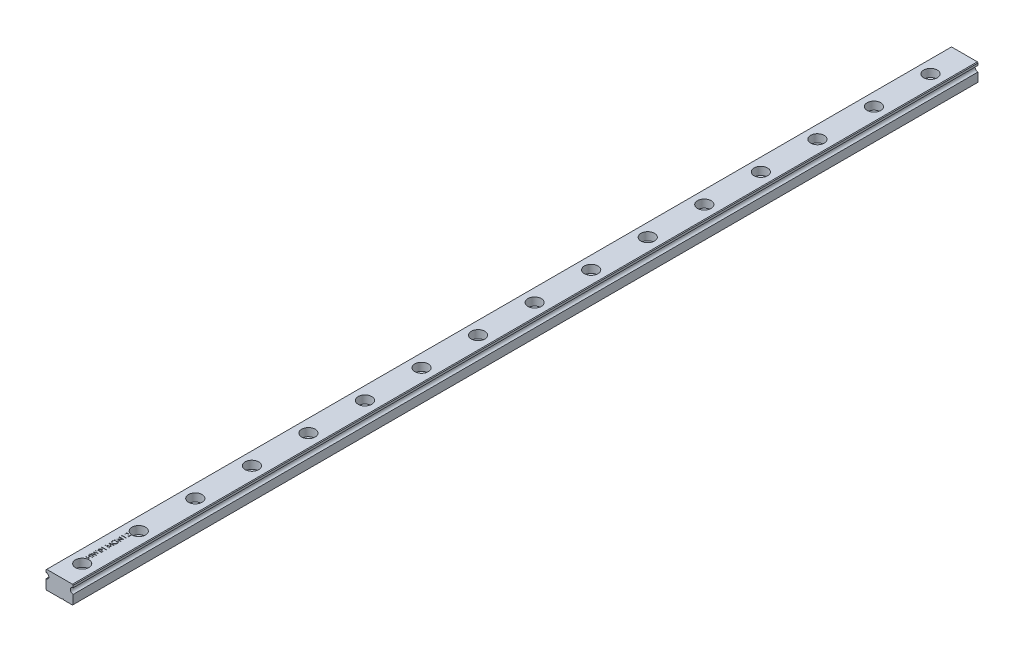
from build123d import *

# Parameters (mm, degrees)
EXTRUDE_1_DEPTH              = 400
HOLE_WIZARD_M3_1_D           = 3.5
HOLE_WIZARD_M3_1_CBORE_D     = 6
HOLE_WIZARD_M3_1_CBORE_DEPTH = 3.5
PATTERN_LINEAR_1_COUNT       = 16
PATTERN_LINEAR_1_PITCH       = 25
SKETCH_6_W                   = 2
SKETCH_6_H                   = 0.17948718
CUT_EXTRUDE_1_DEPTH          = 0.1


with BuildPart() as part:
    # 草图1 → 凸台-拉伸1 (new body)
    with BuildSketch(Plane.XY):
        with BuildLine():
            Line((-5.7, 0), (1.2, 0))
            ThreePointArc((1.2, 0), (1.5, 0.3), (1.8, 0))
            Line((1.8, 0), (5.7, 0))
            Line((5.7, 0), (6, 0.3))
            Line((6, 0.3), (6, 4.25))
            ThreePointArc((6, 4.25), (4.75, 5.5), (6, 6.75))
            Line((6, 6.75), (6, 7.7))
            Line((6, 7.7), (5.7, 8))
            Line((5.7, 8), (-5.7, 8))
            Line((-5.7, 8), (-6, 7.7))
            Line((-6, 7.7), (-6, 6.75))
            ThreePointArc((-6, 6.75), (-4.75, 5.5), (-6, 4.25))
            Line((-6, 4.25), (-6, 0.3))
            Line((-6, 0.3), (-5.7, 0))
        make_face()
    extrude(amount=-EXTRUDE_1_DEPTH)

    # M3 六角凹头螺钉的柱形沉头孔1 (through all)
    with Locations(Plane(origin=(1.750046962, 8, 16.516719317), x_dir=(-1, 0, 0), z_dir=(0, 1, 0))):
        with Locations((1.750046962, -26.516719317)):
            hole_wizard_m3_1 = CounterBoreHole(HOLE_WIZARD_M3_1_D / 2, HOLE_WIZARD_M3_1_CBORE_D / 2, HOLE_WIZARD_M3_1_CBORE_DEPTH)

    # 阵列(线性)1: M3 六角凹头螺钉的柱形沉头孔1 ×16
    with Locations(*[(0, 0, -i * PATTERN_LINEAR_1_PITCH) for i in range(1, PATTERN_LINEAR_1_COUNT)]):
        add(hole_wizard_m3_1, mode=Mode.SUBTRACT)

    # 草图6 → 切除-拉伸1 (cut)
    with BuildSketch(Plane(origin=(0, 8, 0), x_dir=(1, 0, 0), z_dir=(0, 1, 0))):
        Polygon((-2, 13.384615385), (-2, 13.564102564), (-1.179487179, 13.564102564), (-1.179487179, 14.58974359), (-2, 14.58974359), (-2, 14.769230769), (0, 14.769230769), (0, 14.58974359), (-0.974358974, 14.58974359), (-0.974358974, 13.564102564), (0, 13.564102564), (0, 13.384615385), align=None)
        with Locations((-1, 15.371794872)):
            Rectangle(SKETCH_6_W, SKETCH_6_H)
        Polygon((-2, 15.769230769), (-2, 15.954727564), (-0.533253205, 16.346153846), (-2, 16.928285256), (-2, 16.954326923), (-0.543269231, 17.525641026), (-2, 17.919070513), (-2, 18.102564103), (0, 17.563301282), (0, 17.537660256), (-1.529647436, 16.935897436), (0, 16.326923077), (0, 16.301282051), align=None)
        with Locations((-1, 18.653846154)):
            Rectangle(SKETCH_6_W, SKETCH_6_H)
        Polygon((0, 19.179487179), (-2, 19.179487179), (-2, 19.217147436), (-0.42588141, 20.538461538), (-2, 20.538461538), (-2, 20.717948718), (0, 20.717948718), (0, 20.677083333), (-1.570512821, 19.358974359), (0, 19.358974359), align=None)
        Polygon((0, 21.897435897), (-2, 22.161458333), (-2, 22.187099359), (-0.358974359, 23.012820513), (-2, 23.836538462), (-2, 23.862580128), (0, 24.128205128), (0, 23.947916667), (-1.439102564, 23.756410256), (0, 23.034455128), (0, 22.993990385), (-1.442307692, 22.269230769), (0, 22.078125), align=None)
        with BuildLine():
            Line((-1.658653846, 26.41025641), (-1.512820513, 26.256410256))
            add(Edge.make_bspline(
                [(-1.512820513, 26.256410256), (-1.539018354, 26.228576496), (-1.590789334, 26.173572688), (-1.657853757, 26.083744149), (-1.715872573, 25.990397947), (-1.762727196, 25.893383148), (-1.799482431, 25.795243719), (-1.826200124, 25.697667174), (-1.843120215, 25.601285289), (-1.845152455, 25.537191402), (-1.846153846, 25.505608974)],
                knots=[0, 0, 0, 0, 1.089067066, 2.152164705, 3.18986567, 4.218445106, 5.218487318, 6.173592265, 7.100032889, 8, 8, 8, 8], degree=3))
            add(Edge.make_bspline(
                [(-1.846153846, 25.505608974), (-1.8459175, 25.486229146), (-1.84544542, 25.447519751), (-1.839420155, 25.390021497), (-1.830754518, 25.333126276), (-1.818216302, 25.276941491), (-1.802325411, 25.221357898), (-1.782448002, 25.166568819), (-1.759273584, 25.112472036), (-1.732495001, 25.059577168), (-1.703078043, 25.008296749), (-1.670478522, 24.959864751), (-1.635743365, 24.91396963), (-1.597995208, 24.871484369), (-1.557604178, 24.83212636), (-1.515297682, 24.795171675), (-1.470243927, 24.761309058), (-1.422628183, 24.731145835), (-1.37355821, 24.70390721), (-1.323450169, 24.68036881), (-1.272769225, 24.659905979), (-1.221133759, 24.644320859), (-1.169076112, 24.631120359), (-1.116323477, 24.621931082), (-1.062738096, 24.616733186), (-1.026853698, 24.615835763), (-1.008814103, 24.615384615)],
                knots=[0, 0, 0, 0, 1.028150113, 2.053633673, 3.06513288, 4.081487945, 5.106702018, 6.131327874, 7.172780699, 8.228344599, 9.276313556, 10.308389736, 11.324843658, 12.329040066, 13.321460474, 14.316307835, 15.308626991, 16.309440696, 17.305625405, 18.28535951, 19.246194545, 20.203493668, 21.145557131, 22.095268976, 23.042464743, 24, 24, 24, 24], degree=3))
            add(Edge.make_bspline(
                [(-1.008814103, 24.615384615), (-0.990373725, 24.615816727), (-0.953543324, 24.61667977), (-0.898573951, 24.622195883), (-0.844427332, 24.632456003), (-0.791018302, 24.646062717), (-0.738240567, 24.663361389), (-0.686149206, 24.684614254), (-0.634749281, 24.709932044), (-0.584551042, 24.739172769), (-0.535693824, 24.771463893), (-0.489286693, 24.806978856), (-0.445869711, 24.845777448), (-0.404808716, 24.887148273), (-0.366362842, 24.93146827), (-0.330995498, 24.979167431), (-0.298159796, 25.029578056), (-0.268216461, 25.082722506), (-0.241469394, 25.138039066), (-0.217684131, 25.194757027), (-0.198095986, 25.253058685), (-0.182131343, 25.312637352), (-0.169045462, 25.373422082), (-0.160626901, 25.435721397), (-0.154517855, 25.49907723), (-0.154071186, 25.54178502), (-0.153846154, 25.563301282)],
                knots=[0, 0, 0, 0, 0.935915162, 1.869274651, 2.799799983, 3.730201895, 4.664668062, 5.616159355, 6.583070886, 7.570012957, 8.562524459, 9.553461134, 10.53281078, 11.515274572, 12.509912756, 13.507571325, 14.526460018, 15.561318395, 16.601025881, 17.643204557, 18.680545676, 19.719612342, 20.772381578, 21.833430283, 22.908478249, 24, 24, 24, 24], degree=3))
            add(Edge.make_bspline(
                [(-0.153846154, 25.563301282), (-0.154387973, 25.589231872), (-0.155451922, 25.640150798), (-0.163740991, 25.714998695), (-0.176670403, 25.78689162), (-0.195664146, 25.855595527), (-0.219705546, 25.921359753), (-0.249436163, 25.983941746), (-0.284543182, 26.043514314), (-0.324315693, 26.099819605), (-0.368629103, 26.151519046), (-0.416020364, 26.198571662), (-0.467103468, 26.239359446), (-0.521117096, 26.27510077), (-0.5785779, 26.304642052), (-0.639166222, 26.32889684), (-0.70291955, 26.347486815), (-0.746971848, 26.355118294), (-0.769230769, 26.358974359)],
                knots=[0, 0, 0, 0, 1.130199668, 2.219330667, 3.279027493, 4.311506524, 5.322739849, 6.327972234, 7.327472899, 8.33386792, 9.329086447, 10.29244429, 11.240784345, 12.174119183, 13.111530729, 14.052100829, 15.015757696, 16, 16, 16, 16], degree=3))
            Line((-0.769230769, 26.358974359), (-0.769230769, 25.692307692))
            Line((-0.769230769, 25.692307692), (-0.974358974, 25.692307692))
            Line((-0.974358974, 25.692307692), (-0.974358974, 26.538461538))
            add(Edge.make_bspline(
                [(-0.974358974, 26.538461538), (-0.936126124, 26.537486768), (-0.861297528, 26.535578966), (-0.752171659, 26.522196728), (-0.64910212, 26.500587293), (-0.551980365, 26.471067115), (-0.460944026, 26.432852669), (-0.375900674, 26.386354081), (-0.297399714, 26.330827155), (-0.224800283, 26.26824976), (-0.160040733, 26.198021212), (-0.103123054, 26.122039144), (-0.055178703, 26.040178019), (-0.01617261, 25.952515272), (0.014269673, 25.859337881), (0.035853431, 25.760430236), (0.048784839, 25.655926464), (0.050437055, 25.584305506), (0.051282051, 25.547676282)],
                knots=[0, 0, 0, 0, 1.140356446, 2.231883559, 3.274166699, 4.278491846, 5.25512956, 6.21435461, 7.1637429, 8.11826594, 9.068280886, 10.0076534, 10.945064095, 11.891975133, 12.864533718, 13.863980011, 14.907571808, 16, 16, 16, 16], degree=3))
            add(Edge.make_bspline(
                [(0.051282051, 25.547676282), (0.050956839, 25.525099062), (0.050315416, 25.480569507), (0.045756932, 25.414803262), (0.03873946, 25.350850336), (0.028142246, 25.288720046), (0.015162444, 25.22818385), (-0.001458538, 25.169544087), (-0.020697795, 25.112577378), (-0.042581037, 25.057195671), (-0.067936269, 25.003901645), (-0.096113206, 24.952457921), (-0.126966555, 24.902580135), (-0.161029896, 24.85460804), (-0.198048444, 24.808291685), (-0.238096398, 24.763929717), (-0.281051324, 24.721273787), (-0.311553615, 24.694553522), (-0.326923077, 24.681089744)],
                knots=[0, 0, 0, 0, 1.107784379, 2.184907829, 3.233506516, 4.263428166, 5.276301166, 6.270063455, 7.25232949, 8.225834625, 9.190232166, 10.146266622, 11.1027726, 12.066435141, 13.031522626, 14.010570082, 14.99756817, 16, 16, 16, 16], degree=3))
            add(Edge.make_bspline(
                [(-0.326923077, 24.681089744), (-0.351306307, 24.661554925), (-0.399668031, 24.622809547), (-0.477153714, 24.572936314), (-0.557383348, 24.530421227), (-0.640580279, 24.495925329), (-0.726666686, 24.468989279), (-0.815532567, 24.449671421), (-0.907292356, 24.43835297), (-0.969386793, 24.436722377), (-1.000801282, 24.435897436)],
                knots=[0, 0, 0, 0, 1.023165419, 2.029347347, 3.013907458, 3.994755782, 4.975994455, 5.96558838, 6.970761222, 8, 8, 8, 8], degree=3))
            add(Edge.make_bspline(
                [(-1.000801282, 24.435897436), (-1.024324855, 24.436201572), (-1.071073031, 24.436805979), (-1.140477206, 24.444134846), (-1.208649033, 24.454649939), (-1.275532768, 24.47010541), (-1.341173149, 24.489588945), (-1.405600394, 24.513905392), (-1.46885351, 24.542216121), (-1.530493388, 24.575124531), (-1.589716025, 24.611735238), (-1.646231608, 24.651511042), (-1.69912419, 24.694758862), (-1.748516298, 24.74160463), (-1.795139986, 24.791104019), (-1.838021357, 24.844296191), (-1.877831435, 24.90037524), (-1.913805269, 24.959775892), (-1.946129757, 25.021560823), (-1.974465802, 25.08559573), (-1.997885015, 25.15185734), (-2.017755698, 25.21985023), (-2.032450077, 25.290088789), (-2.0431065, 25.362063385), (-2.050398272, 25.436149162), (-2.050984704, 25.486226894), (-2.051282051, 25.51161859)],
                knots=[0, 0, 0, 0, 1.00895651, 2.005089799, 2.991467152, 3.967318338, 4.948153826, 5.927364234, 6.919980553, 7.91976625, 8.923240147, 9.905815003, 10.88314567, 11.851989312, 12.825009789, 13.798721852, 14.781296708, 15.773896486, 16.776076962, 17.771600213, 18.775744723, 19.78957137, 20.808953803, 21.851964491, 22.910847925, 24, 24, 24, 24], degree=3))
            add(Edge.make_bspline(
                [(-2.051282051, 25.51161859), (-2.050950913, 25.532326158), (-2.050294305, 25.573386831), (-2.045743078, 25.63448725), (-2.038529431, 25.694643258), (-2.028685553, 25.753944052), (-2.01527773, 25.81218769), (-1.999232996, 25.869540093), (-1.980551955, 25.9260844), (-1.958272614, 25.981643399), (-1.932984828, 26.036590665), (-1.904520015, 26.091231717), (-1.872391441, 26.145379858), (-1.836503707, 26.19912899), (-1.797473182, 26.252818052), (-1.754183569, 26.305597847), (-1.708341994, 26.358742387), (-1.675380746, 26.392914852), (-1.658653846, 26.41025641)],
                knots=[0, 0, 0, 0, 0.985871117, 1.954866573, 2.915460327, 3.869826059, 4.81536089, 5.759505086, 6.70452669, 7.649098992, 8.607881297, 9.583363685, 10.581137262, 11.603961102, 12.659522466, 13.73993555, 14.853081303, 16, 16, 16, 16], degree=3))
        make_face()
        Polygon((0, 26.948717949), (-2, 26.948717949), (-2, 26.986378205), (-0.42588141, 28.307692308), (-2, 28.307692308), (-2, 28.487179487), (0, 28.487179487), (0, 28.446314103), (-1.570512821, 27.128205128), (0, 27.128205128), align=None)
        Polygon((-2, 29.245592949), (-2, 29.615384615), (0, 29.615384615), (0, 29.435897436), (-1.794871795, 29.435897436), (-1.794871795, 29.128205128), align=None)
        with BuildLine():
            Line((-1.384615385, 30.615384615), (-1.384615385, 30.435897436))
            add(Edge.make_bspline(
                [(-1.384615385, 30.435897436), (-1.40842732, 30.437067238), (-1.455193329, 30.439364697), (-1.523378418, 30.450123719), (-1.588552589, 30.465518506), (-1.65019254, 30.487285052), (-1.708843287, 30.51431721), (-1.764271867, 30.546734369), (-1.816266832, 30.585130855), (-1.864346171, 30.62867756), (-1.908453354, 30.675973925), (-1.946542065, 30.727005891), (-1.978723591, 30.78063162), (-2.005627158, 30.83668842), (-2.025821356, 30.895808742), (-2.04080515, 30.957456089), (-2.049820204, 31.02190131), (-2.050789225, 31.065809894), (-2.051282051, 31.088141026)],
                knots=[0, 0, 0, 0, 1.10065271, 2.161652631, 3.183658789, 4.190468796, 5.17591951, 6.163126047, 7.15150782, 8.156236427, 9.156009102, 10.134482811, 11.092018607, 12.041330605, 13.001268258, 13.972401359, 14.968799086, 16, 16, 16, 16], degree=3))
            add(Edge.make_bspline(
                [(-2.051282051, 31.088141026), (-2.050772814, 31.110072897), (-2.049772181, 31.153168241), (-2.041049796, 31.216038988), (-2.02768352, 31.276032759), (-2.007876804, 31.332469645), (-1.983023708, 31.385928847), (-1.952115628, 31.435748452), (-1.916615028, 31.483133149), (-1.87474033, 31.52575738), (-1.830059922, 31.564912879), (-1.782341621, 31.598662551), (-1.732999429, 31.627728034), (-1.681647911, 31.651517225), (-1.628119842, 31.669550489), (-1.572928413, 31.682911409), (-1.515436679, 31.690549233), (-1.476517528, 31.691715006), (-1.456730769, 31.692307692)],
                knots=[0, 0, 0, 0, 1.111674182, 2.184400057, 3.212814286, 4.223731311, 5.211378316, 6.196328225, 7.191884489, 8.207283132, 9.220262353, 10.201199469, 11.166417575, 12.120932471, 13.06540007, 14.026332106, 14.996573967, 16, 16, 16, 16], degree=3))
            add(Edge.make_bspline(
                [(-1.456730769, 31.692307692), (-1.428874876, 31.691340098), (-1.37365192, 31.68942189), (-1.292500394, 31.673013898), (-1.213876253, 31.647386472), (-1.150595637, 31.616533574), (-1.099609897, 31.585400343), (-1.057610031, 31.557372842), (-1.012399367, 31.524375418), (-0.963794916, 31.486689987), (-0.912433194, 31.443667553), (-0.857266285, 31.396425832), (-0.799314261, 31.34374479), (-0.759706462, 31.306802714), (-0.739182692, 31.287660256)],
                knots=[0, 0, 0, 0, 1.184416499, 2.348048165, 3.509039915, 4.696071444, 5.333504901, 6.05069495, 6.844171097, 7.714965912, 8.667477798, 9.695072654, 10.805644396, 12, 12, 12, 12], degree=3))
            Line((-0.739182692, 31.287660256), (-0.205128205, 30.787259615))
            Line((-0.205128205, 30.787259615), (-0.205128205, 31.717948718))
            Line((-0.205128205, 31.717948718), (0, 31.717948718))
            Line((0, 31.717948718), (0, 30.358974359))
            Line((0, 30.358974359), (-0.827724359, 31.134615385))
            add(Edge.make_bspline(
                [(-0.827724359, 31.134615385), (-0.847437677, 31.153499891), (-0.885302926, 31.189773164), (-0.940584618, 31.241077494), (-0.99187007, 31.287156916), (-1.039062383, 31.328309711), (-1.082851851, 31.363643143), (-1.121820253, 31.394998704), (-1.157679939, 31.420121899), (-1.199246004, 31.447387839), (-1.249995899, 31.473795829), (-1.31201515, 31.496488604), (-1.375859295, 31.51032566), (-1.419003316, 31.511985566), (-1.440705128, 31.512820513)],
                knots=[0, 0, 0, 0, 1.329631726, 2.553950428, 3.673215718, 4.687767853, 5.603093632, 6.413772471, 7.123043292, 7.734684054, 8.834405432, 9.900288307, 10.943827018, 12, 12, 12, 12], degree=3))
            add(Edge.make_bspline(
                [(-1.440705128, 31.512820513), (-1.454351642, 31.512457232), (-1.481246299, 31.511741274), (-1.520678161, 31.50542259), (-1.558715198, 31.495873729), (-1.595474409, 31.482190724), (-1.63058621, 31.46412973), (-1.664093341, 31.442144941), (-1.696487036, 31.416779191), (-1.726860349, 31.387435608), (-1.754678181, 31.355200454), (-1.779320515, 31.321146597), (-1.799914293, 31.285117966), (-1.816796291, 31.247266468), (-1.830039366, 31.207697628), (-1.839215697, 31.166334917), (-1.844977117, 31.123292622), (-1.845756643, 31.093902053), (-1.846153846, 31.078926282)],
                knots=[0, 0, 0, 0, 0.991446411, 1.95395049, 2.89581595, 3.838931463, 4.798493298, 5.75982156, 6.748411868, 7.785213223, 8.824556874, 9.840280684, 10.836137867, 11.835679398, 12.848801643, 13.863922112, 14.911575587, 16, 16, 16, 16], degree=3))
            add(Edge.make_bspline(
                [(-1.846153846, 31.078926282), (-1.845761379, 31.063281881), (-1.844990637, 31.032558859), (-1.839152657, 30.987546407), (-1.830302276, 30.944309984), (-1.816245939, 30.903494716), (-1.799637679, 30.864216774), (-1.778538674, 30.827314679), (-1.754021162, 30.792175744), (-1.725592107, 30.759377937), (-1.693650008, 30.729423101), (-1.65844761, 30.702733775), (-1.620238343, 30.679567443), (-1.579179023, 30.659326804), (-1.534860854, 30.642896888), (-1.487451226, 30.630340261), (-1.437153157, 30.620405072), (-1.402418842, 30.617085896), (-1.384615385, 30.615384615)],
                knots=[0, 0, 0, 0, 1.030878251, 2.024474673, 2.987898669, 3.934362936, 4.864849709, 5.795128259, 6.730474222, 7.685293701, 8.650606017, 9.611896181, 10.591709709, 11.591680886, 12.625074257, 13.701333388, 14.821793024, 16, 16, 16, 16], degree=3))
        make_face()
    extrude(amount=-CUT_EXTRUDE_1_DEPTH, mode=Mode.SUBTRACT)


solid = part.part
